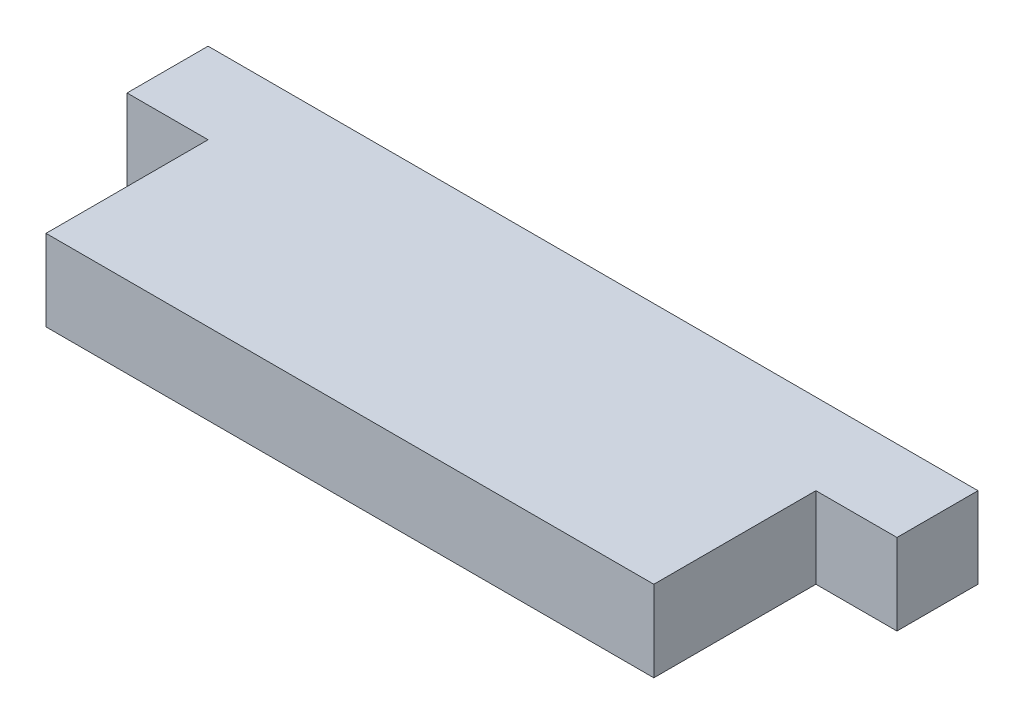
from build123d import *

# Parameters (mm, degrees)
SKETCH1_W           = 15
SKETCH1_H           = 2
BOSS_EXTRUDE1_DEPTH = 4
SKETCH2_W           = 19
SKETCH2_H           = 2
BOSS_EXTRUDE2_DEPTH = 2


with BuildPart() as part:
    # Sketch1 → Boss-Extrude1 (new body)
    with BuildSketch(Plane.XY):
        Rectangle(SKETCH1_W, SKETCH1_H)
    extrude(amount=BOSS_EXTRUDE1_DEPTH)

    # Sketch2 → Boss-Extrude2 (add)
    with BuildSketch(Plane(origin=(0, 0, 0), x_dir=(-1, 0, 0), z_dir=(0, 0, -1))):
        Rectangle(SKETCH2_W, SKETCH2_H)
    extrude(amount=BOSS_EXTRUDE2_DEPTH)


solid = part.part
